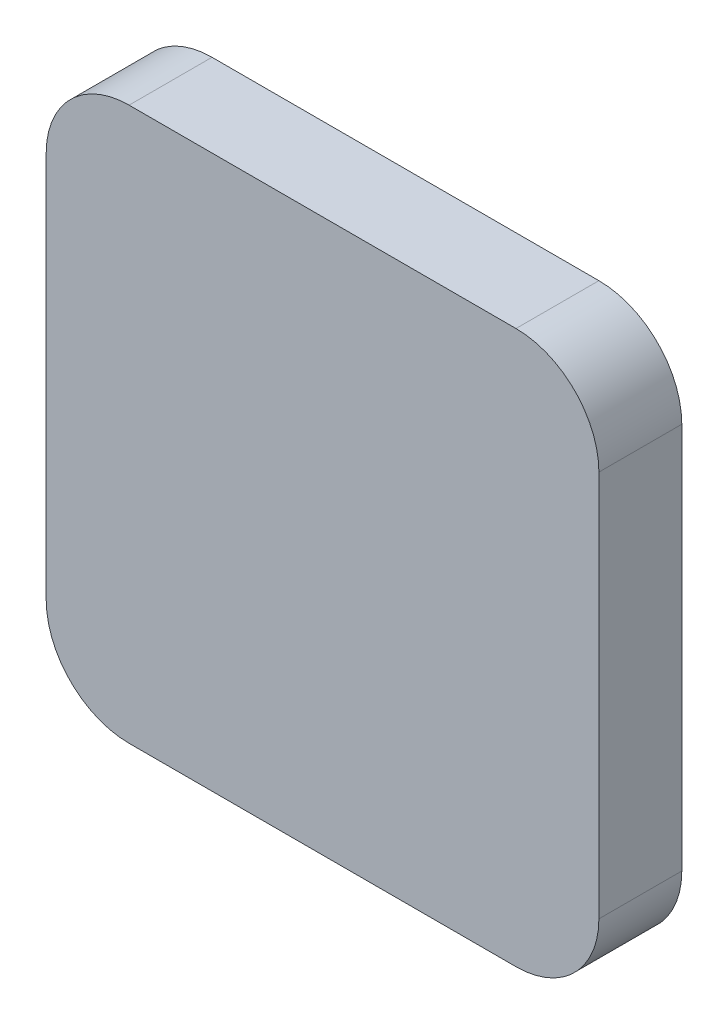
from build123d import *

# Parameters (mm, degrees)
EXTRUDE_1_DEPTH = 3


with BuildPart() as part:
    # 草图1 → 凸台-拉伸1 (new body)
    with BuildSketch(Plane.XY):
        with BuildLine():
            Line((-7, 10), (7, 10))
            ThreePointArc((7, 10), (9.121320344, 9.121320344), (10, 7))
            Line((10, 7), (10, -7))
            ThreePointArc((10, -7), (9.121320344, -9.121320344), (7, -10))
            Line((7, -10), (-7, -10))
            ThreePointArc((-7, -10), (-9.121320344, -9.121320344), (-10, -7))
            Line((-10, -7), (-10, 7))
            ThreePointArc((-10, 7), (-9.121320344, 9.121320344), (-7, 10))
        make_face()
    extrude(amount=EXTRUDE_1_DEPTH)


solid = part.part
